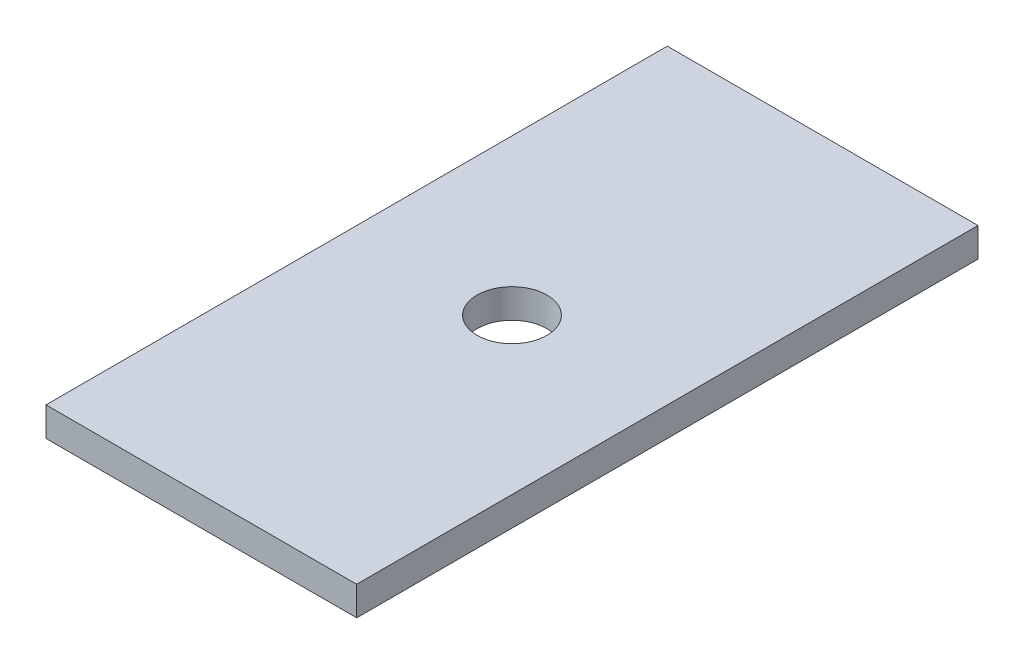
from build123d import *

# Parameters (mm, degrees)
SKETCH1_W           = 127
SKETCH1_H           = 88.9
SKETCH1_R           = 14.2875
BOSS_EXTRUDE1_DEPTH = 11.90625
SKETCH2_W           = 127
SKETCH2_H           = 82.55
BOSS_EXTRUDE2_DEPTH = 11.90625


with BuildPart() as part:
    # Sketch1 → Boss-Extrude1 (new body)
    with BuildSketch(Plane(origin=(0, 0, 0), x_dir=(1, 0, 0), z_dir=(0, 1, 0))):
        with Locations((63.5, 44.45)):
            Rectangle(SKETCH1_W, SKETCH1_H)
        with Locations(Location((63.5, 44.45, 0), (0, 0, 270))):
            Circle(SKETCH1_R, mode=Mode.SUBTRACT)
    extrude(amount=BOSS_EXTRUDE1_DEPTH)

    # Sketch2 → Boss-Extrude2 (add)
    with BuildSketch(Plane(origin=(0, 11.90625, 0), x_dir=(1, 0, 0), z_dir=(0, 1, 0))):
        with Locations((63.5, 130.175)):
            Rectangle(SKETCH2_W, SKETCH2_H)
        with Locations((63.5, -41.275)):
            Rectangle(SKETCH2_W, SKETCH2_H)
    extrude(amount=-BOSS_EXTRUDE2_DEPTH)


solid = part.part
